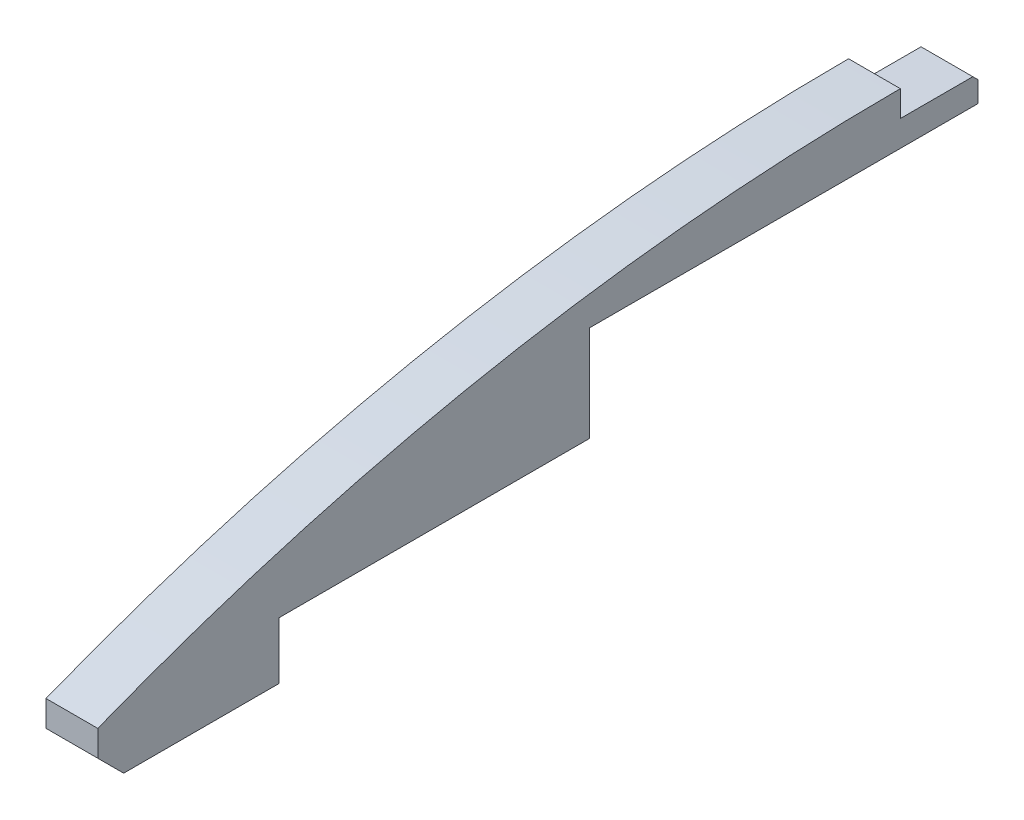
from build123d import *

# Parameters (mm, degrees)
EXTRUDE1_DEPTH = 10


with BuildPart() as part:
    # Sketch1<2> → Extrude1 (new body)
    with BuildSketch(Plane(origin=(0, 0, 0), x_dir=(0, 0, -1), z_dir=(1, 0, 0))):
        with BuildLine():
            Line((-155, 14), (-155, 9))
            Line((-155, 9), (-150, 4))
            Line((-150, 4), (-120, 4))
            Line((-120, 4), (-120, 15))
            Line((-120, 15), (-60, 15))
            Line((-60, 15), (-60, 33.5))
            Line((-60, 33.5), (15, 33.5))
            Line((15, 33.5), (15, 37.5))
            Line((15, 37.5), (14, 38.5))
            Line((14, 38.5), (0, 38.5))
            Line((0, 38.5), (0, 43.5))
            ThreePointArc((0, 43.5), (-78.891143356, 36.059397294), (-155, 14))
        make_face()
    extrude(amount=EXTRUDE1_DEPTH)


solid = part.part
